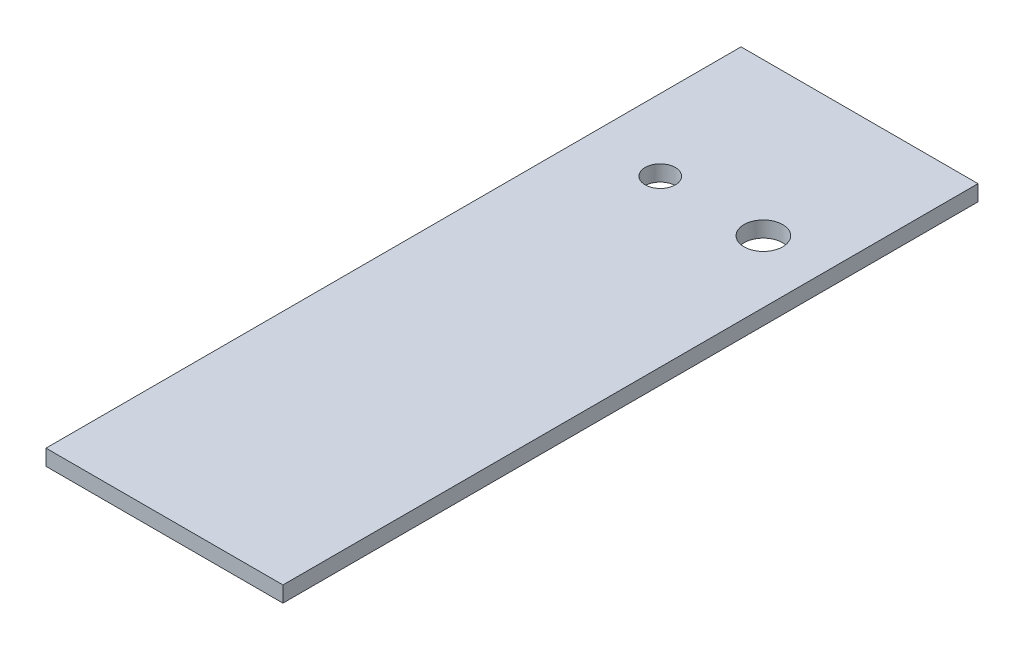
from build123d import *

# Parameters (mm, degrees)
SKETCH1_W           = 95.25
SKETCH1_H           = 279.4
SKETCH1_R           = 6.068485617
SKETCH1_R_2         = 7.770044064
BOSS_EXTRUDE1_DEPTH = 6.35


with BuildPart() as part:
    # Sketch1 → Boss-Extrude1 (new body)
    with BuildSketch(Plane(origin=(0, 0, 0), x_dir=(1, 0, 0), z_dir=(0, 1, 0))):
        with Locations((47.625, -139.7)):
            Rectangle(SKETCH1_W, SKETCH1_H)
        with Locations(Location((28.782424521, -61.256853826, 0), (0, 0, 270))):
            Circle(SKETCH1_R, mode=Mode.SUBTRACT)
        with Locations(Location((70.222659527, -61.256853826, 0), (0, 0, 270))):
            Circle(SKETCH1_R_2, mode=Mode.SUBTRACT)
    extrude(amount=BOSS_EXTRUDE1_DEPTH)


solid = part.part
